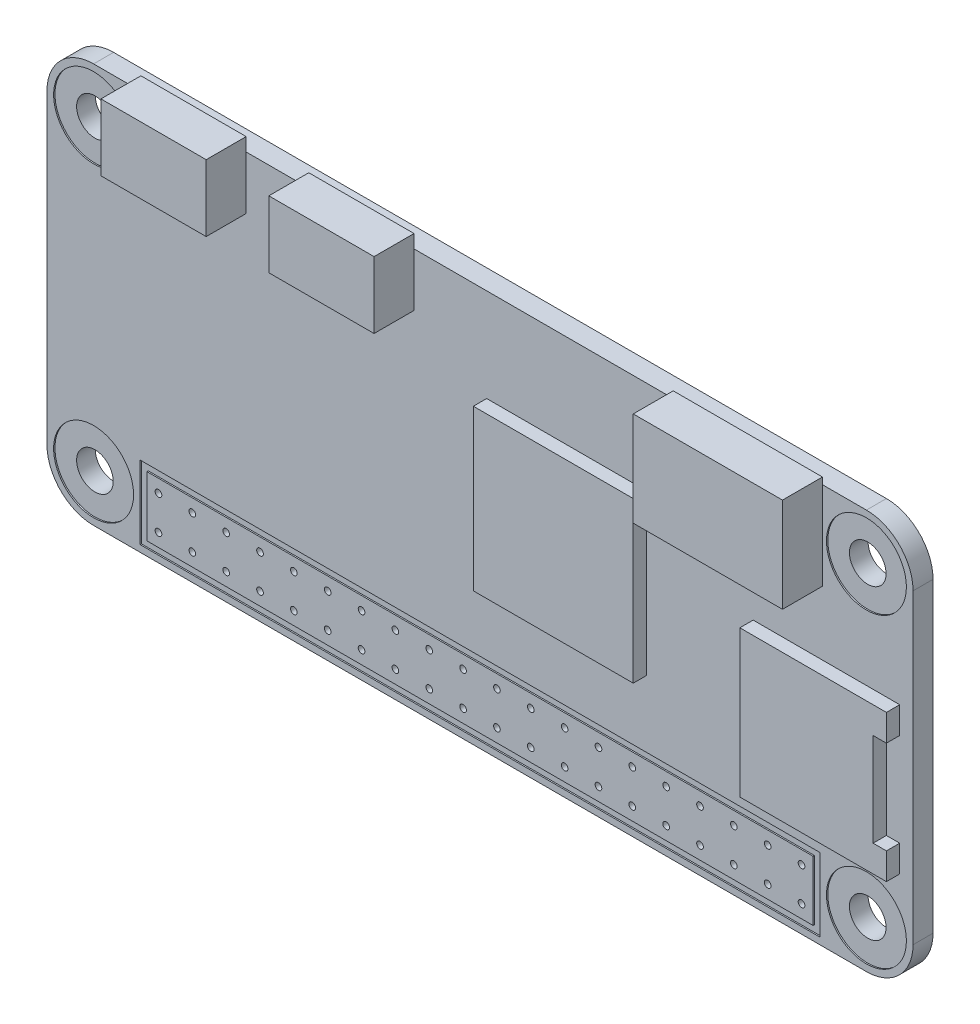
from build123d import *

# Parameters (mm, degrees)
SKETCH_1_W             = 65
SKETCH_1_H             = 30
EXTRUDE_1_DEPTH        = 1.5
FILLET_1_R             = 3.5
SKETCH_2_R             = 1.375
CUT_EXTRUDE_1_DEPTH    = 1.5
SKETCH_3_R             = 3
CUT_EXTRUDE_2_DEPTH    = 0.1
CUT_EXTRUDE_3_REACH    = 37.826
SKETCH_5_R             = 0.25
PATTERN_LINEAR_1_COUNT = 20
PATTERN_LINEAR_1_PITCH = 2.54
SKETCH_6_W             = 11.2
SKETCH_6_H             = 7.1
SKETCH_6_W_2           = 7.9
SKETCH_6_H_2           = 5
EXTRUDE_3_DEPTH        = 3
SKETCH_7_W             = 12
SKETCH_7_H             = 12
EXTRUDE_4_DEPTH        = 1
SKETCH_8_W             = 11
SKETCH_8_H             = 11
EXTRUDE_5_DEPTH        = 1
SKETCH_9_W             = 1
SKETCH_9_H             = 7
CUT_EXTRUDE_4_DEPTH    = 1
SKETCH_4_W             = 51
SKETCH_4_H             = 5.5
SKETCH_4_W_2           = 50
SKETCH_4_H_2           = 4.5
CUT_EXTRUDE_5_DEPTH    = 0.1


with BuildPart() as part:
    # ｽｹｯﾁ1 → ﾎﾞｽ - 押し出し1 (new body)
    with BuildSketch(Plane.XY):
        Rectangle(SKETCH_1_W, SKETCH_1_H)
    extrude(amount=EXTRUDE_1_DEPTH)

    # ﾌｨﾚｯﾄ1
    fillet_1_edges = [part.edges().sort_by_distance(p)[0] for p in [
        (-32.5, 15, 0.75),
        (32.5, 15, 0.75),
        (32.5, -15, 0.75),
        (-32.5, -15, 0.75),
    ]]
    fillet(fillet_1_edges, radius=FILLET_1_R)

    # ｽｹｯﾁ2 → ｶｯﾄ - 押し出し1 (cut)
    with BuildSketch(Plane.XY.offset(1.5)):
        with Locations((29, -11.5)):
            Circle(SKETCH_2_R)
        with Locations((29, 11.5)):
            Circle(SKETCH_2_R)
        with Locations((-29, -11.5)):
            Circle(SKETCH_2_R)
        with Locations((-29, 11.5)):
            Circle(SKETCH_2_R)
    extrude(amount=-CUT_EXTRUDE_1_DEPTH, mode=Mode.SUBTRACT)

    # ｽｹｯﾁ3 → ｶｯﾄ - 押し出し2 (cut)
    with BuildSketch(Plane.XY.offset(1.5)):
        with Locations((29, -11.5)):
            Circle(SKETCH_3_R)
        with Locations((29, 11.5)):
            Circle(SKETCH_3_R)
        with Locations((-29, -11.5)):
            Circle(SKETCH_3_R)
        with Locations((-29, 11.5)):
            Circle(SKETCH_3_R)
    extrude(amount=-CUT_EXTRUDE_2_DEPTH, mode=Mode.SUBTRACT)

    # ｽｹｯﾁ5 → ｶｯﾄ - 押し出し3 (cut, up to next)
    with BuildSketch(Plane.XY.offset(1.5), mode=Mode.PRIVATE) as cut_extrude_3_sk1:
        with Locations((24.13, -13.02)):
            Circle(SKETCH_5_R)
    cut_extrude_3_tool1 = extrude(cut_extrude_3_sk1.sketch, amount=-CUT_EXTRUDE_3_REACH, mode=Mode.PRIVATE) & part.part
    # ｽｹｯﾁ5 → ｶｯﾄ - 押し出し3 (cut, up to next)
    with BuildSketch(Plane.XY.offset(1.5), mode=Mode.PRIVATE) as cut_extrude_3_sk2:
        with Locations((24.13, -10.48)):
            Circle(SKETCH_5_R)
    cut_extrude_3_tool2 = extrude(cut_extrude_3_sk2.sketch, amount=-CUT_EXTRUDE_3_REACH, mode=Mode.PRIVATE) & part.part
    cut_extrude_3_1 = cut_extrude_3_tool1.solids().sort_by_distance((24.13, -13.02, 1.5))[0]
    add(cut_extrude_3_1, mode=Mode.SUBTRACT)
    cut_extrude_3_2 = cut_extrude_3_tool2.solids().sort_by_distance((24.13, -10.48, 1.5))[0]
    add(cut_extrude_3_2, mode=Mode.SUBTRACT)
    cut_extrude_3 = cut_extrude_3_1 + cut_extrude_3_2  # ｶｯﾄ - 押し出し3 as one shape, for the pattern or mirror that repeats it

    # 直線ﾊﾟﾀｰﾝ1: ｶｯﾄ - 押し出し3 ×20
    with Locations(*[(-i * PATTERN_LINEAR_1_PITCH, 0, 0) for i in range(1, PATTERN_LINEAR_1_COUNT)]):
        add(cut_extrude_3, mode=Mode.SUBTRACT)

    # ｽｹｯﾁ6 → ﾎﾞｽ - 押し出し3 (add)
    with BuildSketch(Plane.XY.offset(1.5)):
        with Locations((20.1, 11.95)):
            Rectangle(SKETCH_6_W, SKETCH_6_H)
        with Locations((-8.9, 13.5)):
            Rectangle(SKETCH_6_W_2, SKETCH_6_H_2)
        with Locations((-21.5, 13.5)):
            Rectangle(SKETCH_6_W_2, SKETCH_6_H_2)
    extrude(amount=EXTRUDE_3_DEPTH)

    # ｽｹｯﾁ7 → ﾎﾞｽ - 押し出し4 (add)
    with BuildSketch(Plane.XY.offset(1.5)):
        with Locations((6.5, 2)):
            Rectangle(SKETCH_7_W, SKETCH_7_H)
    extrude(amount=EXTRUDE_4_DEPTH)

    # ｽｹｯﾁ8 → ﾎﾞｽ - 押し出し5 (add)
    with BuildSketch(Plane.XY.offset(1.5)):
        with Locations((26, -1.9)):
            Rectangle(SKETCH_8_W, SKETCH_8_H)
    extrude(amount=EXTRUDE_5_DEPTH)

    # ｽｹｯﾁ9 → ｶｯﾄ - 押し出し4 (cut)
    with BuildSketch(Plane.XY.offset(2.5)):
        with Locations((31, -1.9)):
            Rectangle(SKETCH_9_W, SKETCH_9_H)
    extrude(amount=-CUT_EXTRUDE_4_DEPTH, mode=Mode.SUBTRACT)

    # ｽｹｯﾁ4 → ｶｯﾄ - 押し出し5 (cut)
    with BuildSketch(Plane.XY.offset(1.5)):
        with Locations((0, -11.75)):
            Rectangle(SKETCH_4_W, SKETCH_4_H)
        with Locations((0, -11.75)):
            Rectangle(SKETCH_4_W_2, SKETCH_4_H_2, mode=Mode.SUBTRACT)
    extrude(amount=-CUT_EXTRUDE_5_DEPTH, mode=Mode.SUBTRACT)


solid = part.part
